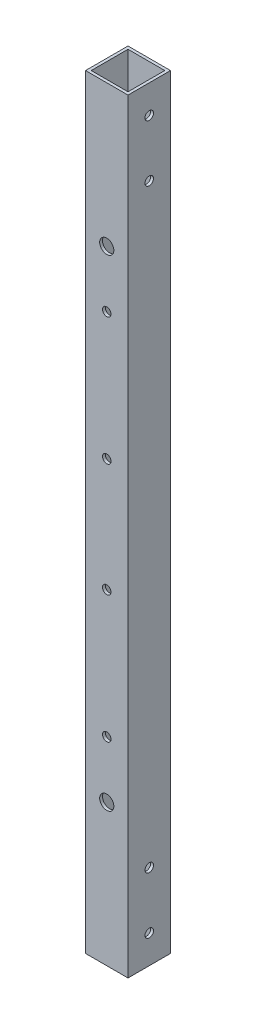
from build123d import *

# Parameters (mm, degrees)
SKETCH_1_W          = 15
SKETCH_1_H          = 15
SKETCH_1_W_2        = 13
SKETCH_1_H_2        = 13
EXTRUDE_1_DEPTH     = 270
SKETCH_2_R          = 1.5
SKETCH_2_R_2        = 2.5
CUT_EXTRUDE_1_DEPTH = 271.520331953
SKETCH_3_R          = 1.5
CUT_EXTRUDE_2_DEPTH = 271.520331953


with BuildPart() as part:
    # 草图1 → 凸台-拉伸1 (new body)
    with BuildSketch(Plane(origin=(0, 0, 0), x_dir=(1, 0, 0), z_dir=(0, 1, 0))):
        Rectangle(SKETCH_1_W, SKETCH_1_H)
        Rectangle(SKETCH_1_W_2, SKETCH_1_H_2, mode=Mode.SUBTRACT)
    extrude(amount=EXTRUDE_1_DEPTH)

    # 草图2 → 切除-拉伸1 (cut, through all)
    with BuildSketch(Plane.XY.offset(7.5)):
        with Locations((0, 155)):
            Circle(SKETCH_2_R)
        with Locations((0, 115)):
            Circle(SKETCH_2_R)
        with Locations((0, 200)):
            Circle(SKETCH_2_R)
        with Locations((0, 70)):
            Circle(SKETCH_2_R)
        with Locations((0, 220)):
            Circle(SKETCH_2_R_2)
        with Locations((0, 50)):
            Circle(SKETCH_2_R_2)
    extrude(amount=-CUT_EXTRUDE_1_DEPTH, mode=Mode.SUBTRACT)

    # 草图3 → 切除-拉伸2 (cut, through all)
    with BuildSketch(Plane(origin=(7.5, 0, 0), x_dir=(0, 0, -1), z_dir=(1, 0, 0))):
        with Locations((0, 240)):
            Circle(SKETCH_3_R)
        with Locations((0, 30)):
            Circle(SKETCH_3_R)
        with Locations((0, 10)):
            Circle(SKETCH_3_R)
        with Locations((0, 260)):
            Circle(SKETCH_3_R)
    extrude(amount=-CUT_EXTRUDE_2_DEPTH, mode=Mode.SUBTRACT)


solid = part.part
